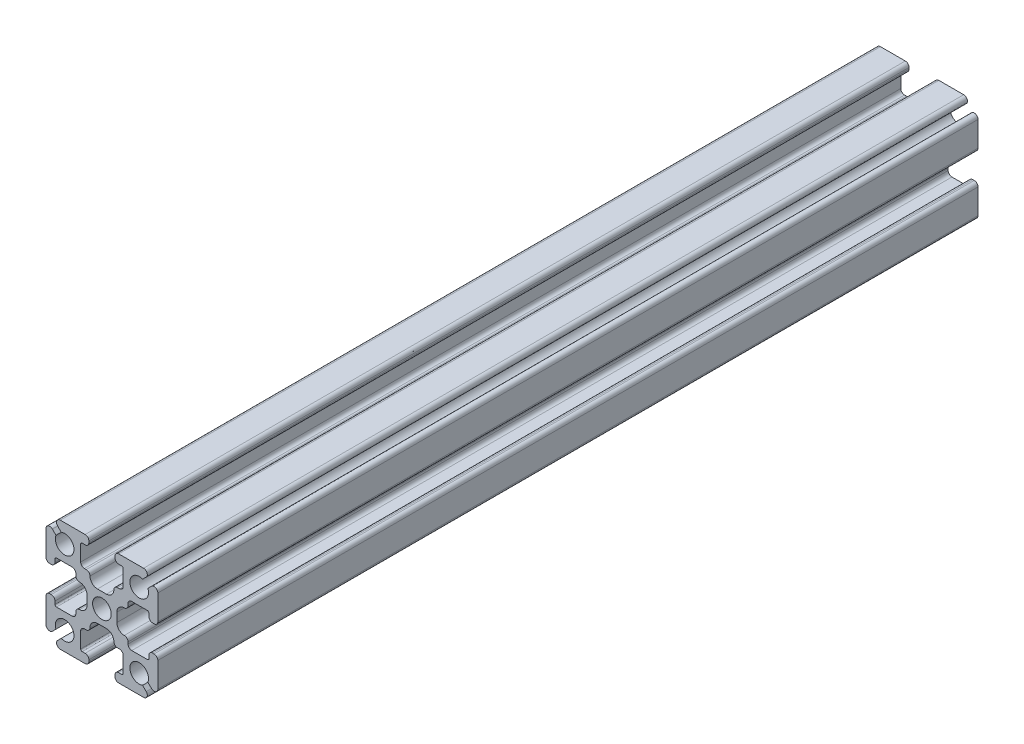
from build123d import *

# Parameters (mm, degrees)
SKETCH1_R           = 1.25
BOSS_EXTRUDE1_DEPTH = 110


with BuildPart() as part:
    # Sketch1 → Boss-Extrude1 (new body)
    with BuildSketch(Plane.XY):
        with BuildLine():
            Line((6.646446609, 5.939339828), (6.163645978, 5.456539197))
            ThreePointArc((6.163645978, 5.456539197), (4.116116524, 4.116116524), (5.456539197, 6.163645978))
            Line((5.456539197, 6.163645978), (5.939339828, 6.646446609))
            ThreePointArc((5.939339828, 6.646446609), (6.047726204, 7.191341716), (5.585786438, 7.5))
            Line((5.585786438, 7.5), (2.25, 7.5))
            ThreePointArc((2.25, 7.5), (1.896446609, 7.353553391), (1.75, 7))
            Line((1.75, 7), (1.75, 6.8))
            ThreePointArc((1.75, 6.8), (1.896446609, 6.446446609), (2.25, 6.3))
            Line((2.25, 6.3), (2.65, 6.3))
            ThreePointArc((2.65, 6.3), (2.791421356, 6.241421356), (2.85, 6.1))
            Line((2.85, 6.1), (2.85, 4))
            ThreePointArc((2.85, 4), (2.703553391, 3.646446609), (2.35, 3.5))
            Line((2.35, 3.5), (2.1, 3.5))
            ThreePointArc((2.1, 3.5), (1.746446609, 3.353553391), (1.6, 3))
            ThreePointArc((1.6, 3), (1.307106781, 2.292893219), (0.6, 2))
            Line((0.6, 2), (-0.6, 2))
            ThreePointArc((-0.6, 2), (-1.307106781, 2.292893219), (-1.6, 3))
            ThreePointArc((-1.6, 3), (-1.746446609, 3.353553391), (-2.1, 3.5))
            Line((-2.1, 3.5), (-2.35, 3.5))
            ThreePointArc((-2.35, 3.5), (-2.703553391, 3.646446609), (-2.85, 4))
            Line((-2.85, 4), (-2.85, 6.1))
            ThreePointArc((-2.85, 6.1), (-2.791421356, 6.241421356), (-2.65, 6.3))
            Line((-2.65, 6.3), (-2.25, 6.3))
            ThreePointArc((-2.25, 6.3), (-1.896446609, 6.446446609), (-1.75, 6.8))
            Line((-1.75, 6.8), (-1.75, 7))
            ThreePointArc((-1.75, 7), (-1.896446609, 7.353553391), (-2.25, 7.5))
            Line((-2.25, 7.5), (-5.585786438, 7.5))
            ThreePointArc((-5.585786438, 7.5), (-6.047726204, 7.191341716), (-5.939339828, 6.646446609))
            Line((-5.939339828, 6.646446609), (-5.456539197, 6.163645978))
            ThreePointArc((-5.456539197, 6.163645978), (-4.116116524, 4.116116524), (-6.163645978, 5.456539197))
            Line((-6.163645978, 5.456539197), (-6.646446609, 5.939339828))
            ThreePointArc((-6.646446609, 5.939339828), (-7.191341716, 6.047726204), (-7.5, 5.585786438))
            Line((-7.5, 5.585786438), (-7.5, 2.25))
            ThreePointArc((-7.5, 2.25), (-7.353553391, 1.896446609), (-7, 1.75))
            Line((-7, 1.75), (-6.8, 1.75))
            ThreePointArc((-6.8, 1.75), (-6.446446609, 1.896446609), (-6.3, 2.25))
            Line((-6.3, 2.25), (-6.3, 2.65))
            ThreePointArc((-6.3, 2.65), (-6.241421356, 2.791421356), (-6.1, 2.85))
            Line((-6.1, 2.85), (-4, 2.85))
            ThreePointArc((-4, 2.85), (-3.646446609, 2.703553391), (-3.5, 2.35))
            Line((-3.5, 2.35), (-3.5, 2.1))
            ThreePointArc((-3.5, 2.1), (-3.353553391, 1.746446609), (-3, 1.6))
            ThreePointArc((-3, 1.6), (-2.292893219, 1.307106781), (-2, 0.6))
            Line((-2, 0.6), (-2, -0.6))
            ThreePointArc((-2, -0.6), (-2.292893219, -1.307106781), (-3, -1.6))
            ThreePointArc((-3, -1.6), (-3.353553391, -1.746446609), (-3.5, -2.1))
            Line((-3.5, -2.1), (-3.5, -2.35))
            ThreePointArc((-3.5, -2.35), (-3.646446609, -2.703553391), (-4, -2.85))
            Line((-4, -2.85), (-6.1, -2.85))
            ThreePointArc((-6.1, -2.85), (-6.241421356, -2.791421356), (-6.3, -2.65))
            Line((-6.3, -2.65), (-6.3, -2.25))
            ThreePointArc((-6.3, -2.25), (-6.446446609, -1.896446609), (-6.8, -1.75))
            Line((-6.8, -1.75), (-7, -1.75))
            ThreePointArc((-7, -1.75), (-7.353553391, -1.896446609), (-7.5, -2.25))
            Line((-7.5, -2.25), (-7.5, -5.585786438))
            ThreePointArc((-7.5, -5.585786438), (-7.191341716, -6.047726204), (-6.646446609, -5.939339828))
            Line((-6.646446609, -5.939339828), (-6.163645978, -5.456539197))
            ThreePointArc((-6.163645978, -5.456539197), (-4.116116524, -4.116116524), (-5.456539197, -6.163645978))
            Line((-5.456539197, -6.163645978), (-5.939339828, -6.646446609))
            ThreePointArc((-5.939339828, -6.646446609), (-6.047726204, -7.191341716), (-5.585786438, -7.5))
            Line((-5.585786438, -7.5), (-2.25, -7.5))
            ThreePointArc((-2.25, -7.5), (-1.896446609, -7.353553391), (-1.75, -7))
            Line((-1.75, -7), (-1.75, -6.8))
            ThreePointArc((-1.75, -6.8), (-1.896446609, -6.446446609), (-2.25, -6.3))
            Line((-2.25, -6.3), (-2.65, -6.3))
            ThreePointArc((-2.65, -6.3), (-2.791421356, -6.241421356), (-2.85, -6.1))
            Line((-2.85, -6.1), (-2.85, -4))
            ThreePointArc((-2.85, -4), (-2.703553391, -3.646446609), (-2.35, -3.5))
            Line((-2.35, -3.5), (-2.1, -3.5))
            ThreePointArc((-2.1, -3.5), (-1.746446609, -3.353553391), (-1.6, -3))
            ThreePointArc((-1.6, -3), (-1.307106781, -2.292893219), (-0.6, -2))
            Line((-0.6, -2), (0.6, -2))
            ThreePointArc((0.6, -2), (1.307106781, -2.292893219), (1.6, -3))
            ThreePointArc((1.6, -3), (1.746446609, -3.353553391), (2.1, -3.5))
            Line((2.1, -3.5), (2.35, -3.5))
            ThreePointArc((2.35, -3.5), (2.703553391, -3.646446609), (2.85, -4))
            Line((2.85, -4), (2.85, -6.1))
            ThreePointArc((2.85, -6.1), (2.791421356, -6.241421356), (2.65, -6.3))
            Line((2.65, -6.3), (2.25, -6.3))
            ThreePointArc((2.25, -6.3), (1.896446609, -6.446446609), (1.75, -6.8))
            Line((1.75, -6.8), (1.75, -7))
            ThreePointArc((1.75, -7), (1.896446609, -7.353553391), (2.25, -7.5))
            Line((2.25, -7.5), (5.585786438, -7.5))
            ThreePointArc((5.585786438, -7.5), (6.047726204, -7.191341716), (5.939339828, -6.646446609))
            Line((5.939339828, -6.646446609), (5.456539197, -6.163645978))
            ThreePointArc((5.456539197, -6.163645978), (4.116116524, -4.116116524), (6.163645978, -5.456539197))
            Line((6.163645978, -5.456539197), (6.646446609, -5.939339828))
            ThreePointArc((6.646446609, -5.939339828), (7.191341716, -6.047726204), (7.5, -5.585786438))
            Line((7.5, -5.585786438), (7.5, -2.25))
            ThreePointArc((7.5, -2.25), (7.353553391, -1.896446609), (7, -1.75))
            Line((7, -1.75), (6.8, -1.75))
            ThreePointArc((6.8, -1.75), (6.446446609, -1.896446609), (6.3, -2.25))
            Line((6.3, -2.25), (6.3, -2.65))
            ThreePointArc((6.3, -2.65), (6.241421356, -2.791421356), (6.1, -2.85))
            Line((6.1, -2.85), (4, -2.85))
            ThreePointArc((4, -2.85), (3.646446609, -2.703553391), (3.5, -2.35))
            Line((3.5, -2.35), (3.5, -2.1))
            ThreePointArc((3.5, -2.1), (3.353553391, -1.746446609), (3, -1.6))
            ThreePointArc((3, -1.6), (2.292893219, -1.307106781), (2, -0.6))
            Line((2, -0.6), (2, 0.6))
            ThreePointArc((2, 0.6), (2.292893219, 1.307106781), (3, 1.6))
            ThreePointArc((3, 1.6), (3.353553391, 1.746446609), (3.5, 2.1))
            Line((3.5, 2.1), (3.5, 2.35))
            ThreePointArc((3.5, 2.35), (3.646446609, 2.703553391), (4, 2.85))
            Line((4, 2.85), (6.1, 2.85))
            ThreePointArc((6.1, 2.85), (6.241421356, 2.791421356), (6.3, 2.65))
            Line((6.3, 2.65), (6.3, 2.25))
            ThreePointArc((6.3, 2.25), (6.446446609, 1.896446609), (6.8, 1.75))
            Line((6.8, 1.75), (7, 1.75))
            ThreePointArc((7, 1.75), (7.353553391, 1.896446609), (7.5, 2.25))
            Line((7.5, 2.25), (7.5, 5.585786438))
            ThreePointArc((7.5, 5.585786438), (7.191341716, 6.047726204), (6.646446609, 5.939339828))
        make_face()
        with Locations(Location((0, 0, 0), (0, 0, 180))):
            Circle(SKETCH1_R, mode=Mode.SUBTRACT)
    extrude(amount=BOSS_EXTRUDE1_DEPTH)


solid = part.part
